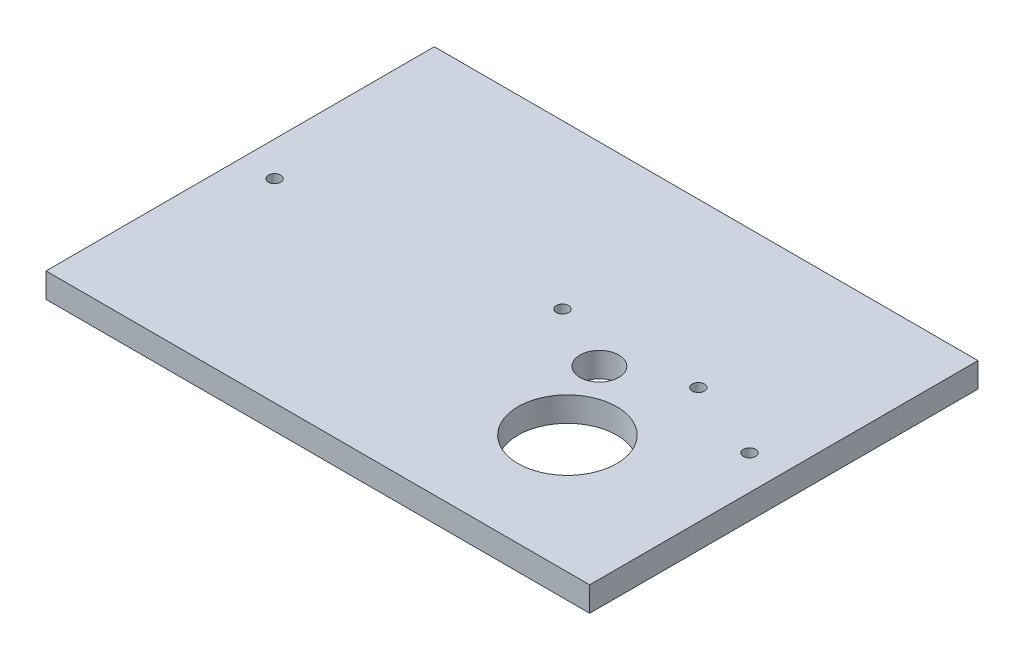
from build123d import *

# Parameters (mm, degrees)
SKETCH1_W           = 140
SKETCH1_H           = 100
BOSS_EXTRUDE1_DEPTH = 6.35
SKETCH2_R           = 12.705
SKETCH2_R_2         = 5
CUT_EXTRUDE1_DEPTH  = 10
SKETCH3_R           = 1.5875
CUT_EXTRUDE2_DEPTH  = 10


with BuildPart() as part:
    # Sketch1 → Boss-Extrude1 (new body)
    with BuildSketch(Plane(origin=(0, 0, 0), x_dir=(1, 0, 0), z_dir=(0, 1, 0))):
        with Locations((70, 50)):
            Rectangle(SKETCH1_W, SKETCH1_H)
    extrude(amount=BOSS_EXTRUDE1_DEPTH)

    # Sketch2 → Cut-Extrude1 (cut)
    with BuildSketch(Plane(origin=(0, 6.35, 0), x_dir=(1, 0, 0), z_dir=(0, 1, 0))):
        with Locations(Location((103.75, 30.514428415, 0), (0, 0, 270))):
            Circle(SKETCH2_R)
        with Locations(Location((92.5, 50, 0), (0, 0, 270))):
            Circle(SKETCH2_R_2)
    extrude(amount=-CUT_EXTRUDE1_DEPTH, mode=Mode.SUBTRACT)

    # Sketch3 → Cut-Extrude2 (cut)
    with BuildSketch(Plane(origin=(0, 6.35, 0), x_dir=(1, 0, 0), z_dir=(0, 1, 0))):
        with Locations(Location((8.85, 50, 0), (0, 0, 270))):
            Circle(SKETCH3_R)
        with Locations(Location((131.15, 50, 0), (0, 0, 270))):
            Circle(SKETCH3_R)
        with Locations(Location((75, 58, 0), (0, 0, 270))):
            Circle(SKETCH3_R)
        with Locations(Location((110, 58, 0), (0, 0, 270))):
            Circle(SKETCH3_R)
    extrude(amount=-CUT_EXTRUDE2_DEPTH, mode=Mode.SUBTRACT)


solid = part.part
